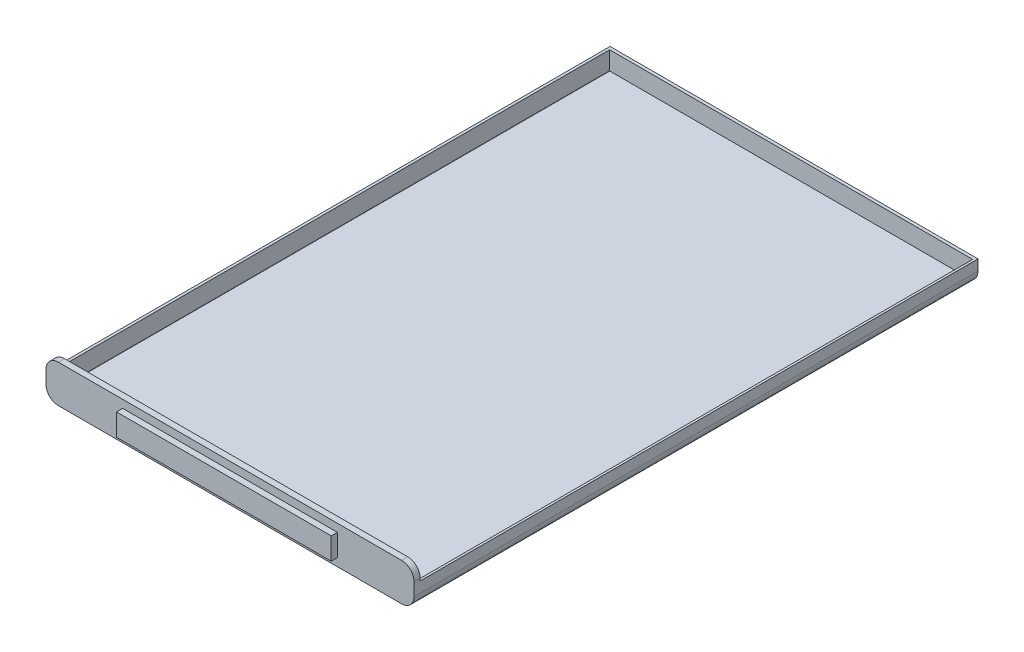
from build123d import *
from build123d.topology import SkipClean

# Parameters (mm, degrees)
SKETCH2_W           = 60.23261123
SKETCH2_H           = 92
SKETCH2_W_2         = 59.23261123
SKETCH2_H_2         = 91
BOSS_EXTRUDE1_DEPTH = 3
SKETCH2_2_W         = 60.23261123
SKETCH2_2_H         = 92
BOSS_EXTRUDE2_DEPTH = 1
SKETCH3_W           = 35.019424251
SKETCH3_H           = 3.582680393
BOSS_EXTRUDE3_DEPTH = 1
BOSS_EXTRUDE5_DEPTH = 1
CUT_EXTRUDE2_DEPTH  = 98.380770332


with BuildPart() as part:
    # Sketch2 → Boss-Extrude1 (new body)
    with BuildSketch(Plane(origin=(0, 0, 0), x_dir=(1, 0, 0), z_dir=(0, 1, 0))):
        with Locations((1.344327409, 2.772982692)):
            Rectangle(SKETCH2_W, SKETCH2_H)
        with Locations((1.344327409, 2.772982692)):
            Rectangle(SKETCH2_W_2, SKETCH2_H_2, mode=Mode.SUBTRACT)
    extrude(amount=BOSS_EXTRUDE1_DEPTH)

    # Sketch2<2> → Boss-Extrude2 (add)
    with BuildSketch(Plane(origin=(0, 0, 0), x_dir=(1, 0, 0), z_dir=(0, 1, 0))):
        with Locations((1.344327409, 2.772982692)):
            Rectangle(SKETCH2_2_W, SKETCH2_2_H)
    extrude(amount=-BOSS_EXTRUDE2_DEPTH)

    # Sketch3 → Boss-Extrude3 (add)
    with BuildSketch(Plane.XY.offset(43.227017308)):
        with Locations((1.310252146, 2.334822514)):
            Rectangle(SKETCH3_W, SKETCH3_H)
    extrude(amount=BOSS_EXTRUDE3_DEPTH)

    # Sketch3<5> → Boss-Extrude5 (add)
    with BuildSketch(Plane.XY.offset(43.227017308)):
        with BuildLine():
            Line((29.319964272, 5.407679734), (-26.699459979, 5.407679734))
            ThreePointArc((-26.699459979, 5.407679734), (-28.113673542, 4.821893296), (-28.699459979, 3.407679734))
            Line((-28.699459979, 3.407679734), (-28.699459979, 1.263953606))
            ThreePointArc((-28.699459979, 1.263953606), (-28.113673542, -0.150259957), (-26.699459979, -0.736046394))
            Line((-26.699459979, -0.736046394), (29.319964272, -0.736046394))
            ThreePointArc((29.319964272, -0.736046394), (30.734177835, -0.150259957), (31.319964272, 1.263953606))
            Line((31.319964272, 1.263953606), (31.319964272, 3.407679734))
            ThreePointArc((31.319964272, 3.407679734), (30.734177835, 4.821893296), (29.319964272, 5.407679734))
        make_face()
    extrude(amount=-BOSS_EXTRUDE5_DEPTH)

    # Sketch3<6> → Cut-Extrude2 (cut, through all)
    with SkipClean():  # the faces are left unmerged after this step: merging them gives an invalid solid
        with BuildSketch(Plane.XY.offset(43.227017308)):
            with BuildLine():
                Line((31.460633024, 3), (31.319964272, 3))
                Line((31.319964272, 3), (31.319964272, 1.263953606))
                ThreePointArc((31.319964272, 1.263953606), (30.967290445, 0.129794675), (30.033647793, -0.604376085))
                ThreePointArc((30.033647793, -0.604376085), (29.682828309, -0.702853373), (29.319964272, -0.736046394))
                Line((29.319964272, -0.736046394), (-26.699459979, -0.736046394))
                ThreePointArc((-26.699459979, -0.736046394), (-27.062324016, -0.702853373), (-27.4131435, -0.604376085))
                ThreePointArc((-27.4131435, -0.604376085), (-28.346786152, 0.129794675), (-28.699459979, 1.263953606))
                Line((-28.699459979, 1.263953606), (-28.699459979, 3))
                Line((-28.699459979, 3), (-28.771978206, 3))
                Line((-28.771978206, 3), (-28.771978206, -1))
                Line((-28.771978206, -1), (31.460633024, -1))
                Line((31.460633024, -1), (31.460633024, 3))
            make_face()
        extrude(amount=-CUT_EXTRUDE2_DEPTH, mode=Mode.SUBTRACT)


solid = part.part
